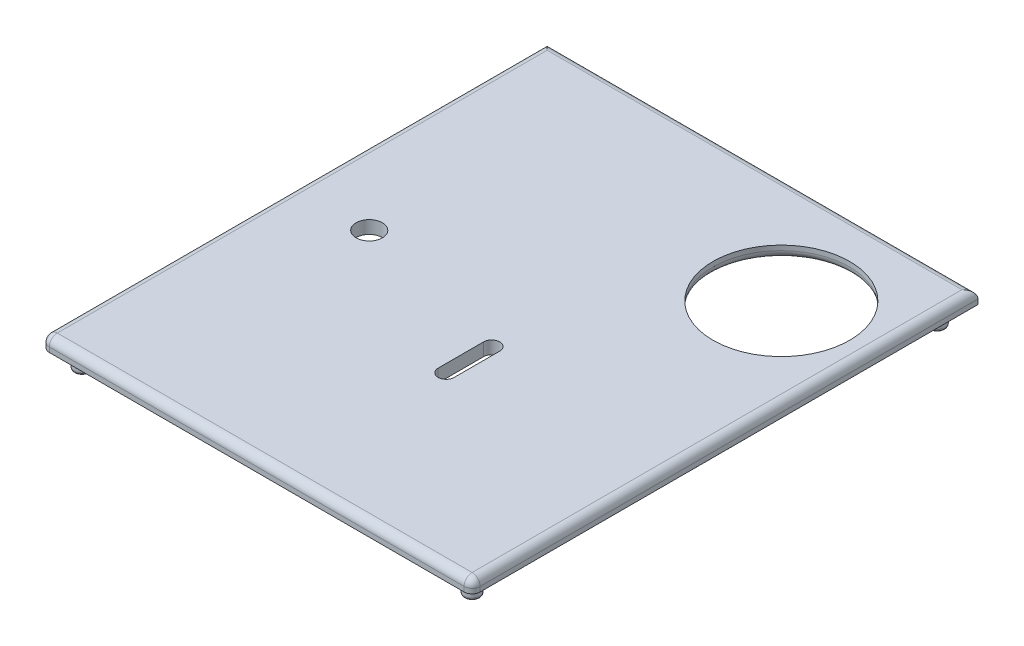
from build123d import *

# Parameters (mm, degrees)
SKETCH1_W               = 80.4
SKETCH1_H               = 94.4
SKETCH1_R               = 2.45
SKETCH1_R_2             = 12.75
SKETCH1_R_3             = 1.45
BOSS_EXTRUDE1_DEPTH     = 2.4
FILLET1_R               = 1.5
SKETCH2_W               = 2
SKETCH2_H               = 12
BOSS_EXTRUDE2_DEPTH     = 2.6
FILLET2_R               = 0.5
SKETCH1_4_R             = 1.45
BOSS_EXTRUDE3_DEPTH     = 3.5
FILLET3_R               = 0.5
CUT_EXTRUDE1_DEPTH      = 63.279129731
CUT_EXTRUDE1_DEPTH_BACK = 63.279129731


with BuildPart() as part:
    # Sketch1 → Boss-Extrude1 (new body)
    # profile 1 of 5: a face of its own
    with BuildSketch(Plane(origin=(0, 0, 0), x_dir=(1, 0, 0), z_dir=(0, 1, 0))):
        Rectangle(SKETCH1_W, SKETCH1_H)
        with Locations(Location((-26.2, 0, 0), (0, 0, 270))):
            Circle(SKETCH1_R, mode=Mode.SUBTRACT)
        with Locations(Location((23.65, 27.05, 0), (0, 0, 270))):
            Circle(SKETCH1_R_2, mode=Mode.SUBTRACT)
        with Locations((-36.4, -43.4)):
            Circle(SKETCH1_R_3, mode=Mode.SUBTRACT)
        with Locations((36.4, -43.4)):
            Circle(SKETCH1_R_3, mode=Mode.SUBTRACT)
        with Locations((36.4, 43.4)):
            Circle(SKETCH1_R_3, mode=Mode.SUBTRACT)
        with Locations((-36.4, 43.4)):
            Circle(SKETCH1_R_3, mode=Mode.SUBTRACT)
    # profile 2 of 5: a face of its own
    with BuildSketch(Plane(origin=(0, 0, 0), x_dir=(1, 0, 0), z_dir=(0, 1, 0))):
        with Locations((-36.4, -43.4)):
            Circle(SKETCH1_R_3)
    # profile 3 of 5: a face of its own
    with BuildSketch(Plane(origin=(0, 0, 0), x_dir=(1, 0, 0), z_dir=(0, 1, 0))):
        with Locations((-36.4, 43.4)):
            Circle(SKETCH1_R_3)
    # profile 4 of 5: a face of its own
    with BuildSketch(Plane(origin=(0, 0, 0), x_dir=(1, 0, 0), z_dir=(0, 1, 0))):
        with Locations((36.4, 43.4)):
            Circle(SKETCH1_R_3)
    # profile 5 of 5: a face of its own
    with BuildSketch(Plane(origin=(0, 0, 0), x_dir=(1, 0, 0), z_dir=(0, 1, 0))):
        with Locations((36.4, -43.4)):
            Circle(SKETCH1_R_3)
    extrude(amount=BOSS_EXTRUDE1_DEPTH)

    # Fillet1
    fillet1_edges = [part.edges().sort_by_distance(p)[0] for p in [
        (23.65, 0, -39.8),
        (-40.2, 1.2, 47.2),
        (40.2, 1.2, 47.2),
        (0, 2.4, 47.2),
        (40.2, 2.4, 0),
        (0, 2.4, -47.2),
        (-40.2, 2.4, 0),
    ]]
    fillet(fillet1_edges, radius=FILLET1_R)

    # Sketch2 → Boss-Extrude2 (add)
    with BuildSketch(Plane.XZ):
        with Locations((36.9, -1.8)):
            Rectangle(SKETCH2_W, SKETCH2_H)
        with Locations((-36.9, -1.8)):
            Rectangle(SKETCH2_W, SKETCH2_H)
    extrude(amount=BOSS_EXTRUDE2_DEPTH)

    # Fillet2
    fillet2_edges = [part.edges().sort_by_distance(p)[0] for p in [
        (37.9, -2.6, -1.8),
        (-37.9, -2.6, -1.8),
    ]]
    fillet(fillet2_edges, radius=FILLET2_R)

    # Sketch1<4> → Boss-Extrude3 (add)
    with BuildSketch(Plane(origin=(0, 0, 0), x_dir=(1, 0, 0), z_dir=(0, 1, 0))):
        with Locations(Location((36.4, 43.4, 0), (0, 0, 270))):
            Circle(SKETCH1_4_R)
        with Locations(Location((-36.4, 43.4, 0), (0, 0, 270))):
            Circle(SKETCH1_4_R)
        with Locations(Location((-36.4, -43.4, 0), (0, 0, 270))):
            Circle(SKETCH1_4_R)
        with Locations(Location((36.4, -43.4, 0), (0, 0, 270))):
            Circle(SKETCH1_4_R)
    extrude(amount=-BOSS_EXTRUDE3_DEPTH)

    # Fillet3
    fillet3_edges = [part.edges().sort_by_distance(p)[0] for p in [
        (36.4, -3.5, -44.85),
        (-36.4, -3.5, -44.85),
        (-36.4, -3.5, 41.95),
        (36.4, -3.5, 41.95),
    ]]
    fillet(fillet3_edges, radius=FILLET3_R)

    # Sketch3 → Cut-Extrude1 (cut, two sides: drawn at the far end of the back side and taken through both)
    with BuildSketch(Plane(origin=(0, 2.4, 0), x_dir=(1, 0, 0), z_dir=(0, 1, 0)).offset(-CUT_EXTRUDE1_DEPTH_BACK)):
        with BuildLine():
            Line((5.5, -7.35), (5.5, -15.85))
            ThreePointArc((5.5, -15.85), (4, -17.35), (2.5, -15.85))
            Line((2.5, -15.85), (2.5, -7.35))
            ThreePointArc((2.5, -7.35), (4, -5.85), (5.5, -7.35))
        make_face()
    extrude(amount=CUT_EXTRUDE1_DEPTH + CUT_EXTRUDE1_DEPTH_BACK, mode=Mode.SUBTRACT)


solid = part.part
